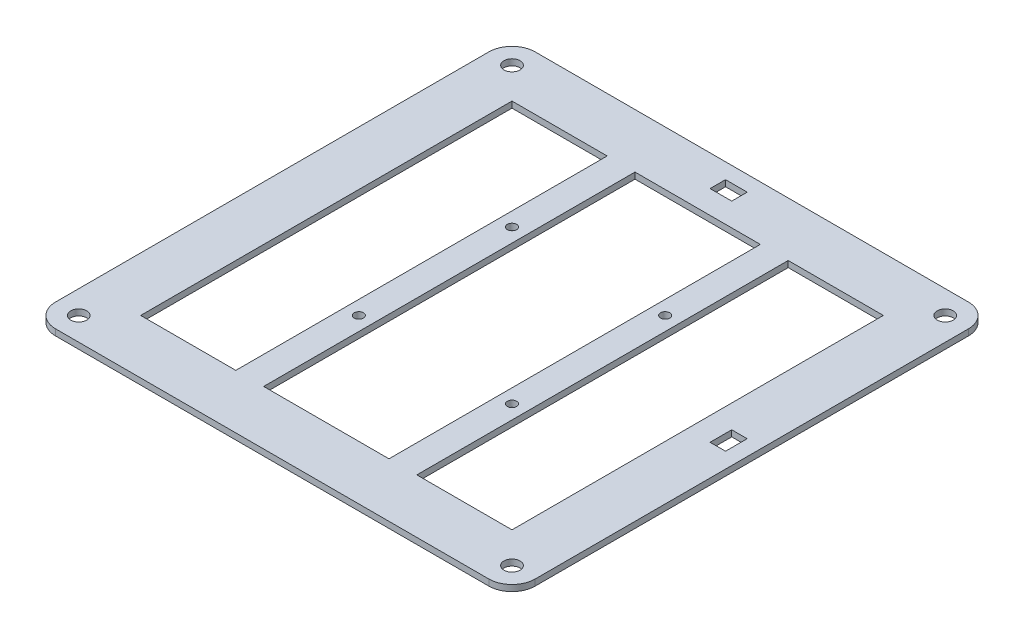
from build123d import *

# Parameters (mm, degrees)
CROQUIS1_W              = 160
CROQUIS1_H              = 160
CROQUIS1_R              = 1.5
CROQUIS1_R_2            = 2.6
CROQUIS1_W_2            = 30.75
CROQUIS1_H_2            = 120
CROQUIS1_W_3            = 40.5
CROQUIS1_W_4            = 5
CROQUIS1_H_3            = 7
CROQUIS1_W_5            = 7
CROQUIS1_H_4            = 5
SALIENTE_EXTRUIR1_DEPTH = 2
CROQUIS2_W              = 160
CROQUIS2_H              = 160
CORTAR_EXTRUIR1_DEPTH   = 74


with BuildPart() as part:
    # Croquis1 → Saliente-Extruir1 (new body)
    with BuildSketch(Plane(origin=(0, 0, 0), x_dir=(1, 0, 0), z_dir=(0, 1, 0))):
        with Locations((70, 70)):
            Rectangle(CROQUIS1_W, CROQUIS1_H)
        with Locations(Location((45.25, 94.75, 0), (0, 0, 270))):
            Circle(CROQUIS1_R, mode=Mode.SUBTRACT)
        with Locations(Location((45.25, 45.25, 0), (0, 0, 270))):
            Circle(CROQUIS1_R, mode=Mode.SUBTRACT)
        with Locations(Location((0, 140, 0), (0, 0, 270))):
            Circle(CROQUIS1_R_2, mode=Mode.SUBTRACT)
        with Locations(Location((0, 0, 0), (0, 0, 270))):
            Circle(CROQUIS1_R_2, mode=Mode.SUBTRACT)
        with Locations(Location((94.75, 94.75, 0), (0, 0, 90))):
            Circle(CROQUIS1_R, mode=Mode.SUBTRACT)
        with Locations(Location((94.75, 45.25, 0), (0, 0, 90))):
            Circle(CROQUIS1_R, mode=Mode.SUBTRACT)
        with Locations(Location((140, 0, 0), (0, 0, 90))):
            Circle(CROQUIS1_R_2, mode=Mode.SUBTRACT)
        with Locations(Location((140, 140, 0), (0, 0, 90))):
            Circle(CROQUIS1_R_2, mode=Mode.SUBTRACT)
        with Locations((25.375, 70)):
            Rectangle(CROQUIS1_W_2, CROQUIS1_H_2, mode=Mode.SUBTRACT)
        with Locations((114.625, 70)):
            Rectangle(CROQUIS1_W_2, CROQUIS1_H_2, mode=Mode.SUBTRACT)
        with Locations((70, 70)):
            Rectangle(CROQUIS1_W_3, CROQUIS1_H_2, mode=Mode.SUBTRACT)
        with Locations((140, 70)):
            Rectangle(CROQUIS1_W_4, CROQUIS1_H_3, mode=Mode.SUBTRACT)
        with Locations((70, 140)):
            Rectangle(CROQUIS1_W_5, CROQUIS1_H_4, mode=Mode.SUBTRACT)
    extrude(amount=SALIENTE_EXTRUIR1_DEPTH)

    # Croquis2 → Cortar-Extruir1 (cut)
    with BuildSketch(Plane(origin=(0, 2, 0), x_dir=(1, 0, 0), z_dir=(0, 1, 0))):
        with Locations((70, 70)):
            Rectangle(CROQUIS2_W, CROQUIS2_H)
        with BuildLine():
            Line((0, -7.5), (140, -7.5))
            ThreePointArc((140, -7.5), (145.303300859, -5.303300859), (147.5, 0))
            Line((147.5, 0), (147.5, 140))
            ThreePointArc((147.5, 140), (145.303300859, 145.303300859), (140, 147.5))
            Line((140, 147.5), (0, 147.5))
            ThreePointArc((0, 147.5), (-5.303300859, 145.303300859), (-7.5, 140))
            Line((-7.5, 140), (-7.5, 0))
            ThreePointArc((-7.5, 0), (-5.303300859, -5.303300859), (0, -7.5))
        make_face(mode=Mode.SUBTRACT)
    extrude(amount=-CORTAR_EXTRUIR1_DEPTH, mode=Mode.SUBTRACT)


solid = part.part
